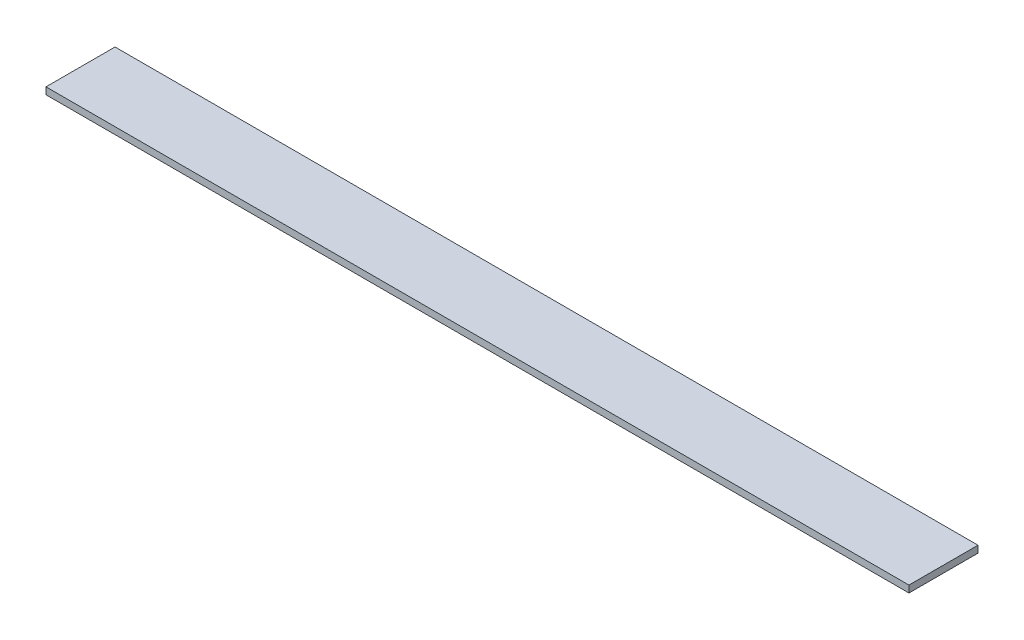
from build123d import *

# Parameters (mm, degrees)
SKETCH_1_W      = 500
SKETCH_1_H      = 40
EXTRUDE_1_DEPTH = 4


with BuildPart() as part:
    # Эскиз1 → Бобышка-Вытянуть1 (new body)
    with BuildSketch(Plane(origin=(0, 0, 0), x_dir=(1, 0, 0), z_dir=(0, 1, 0))):
        with Locations((250, 20)):
            Rectangle(SKETCH_1_W, SKETCH_1_H)
    extrude(amount=EXTRUDE_1_DEPTH)


solid = part.part
